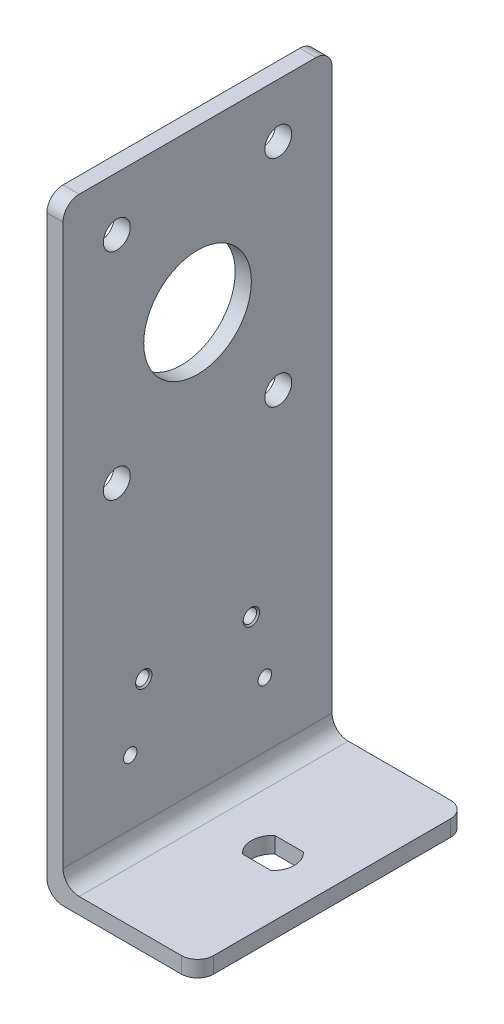
from build123d import *

# Parameters (mm, degrees)
EXTRUDE_THIN1_DEPTH         = 50
HOLE1_D                     = 5
SKETCH3_R                   = 10
CUT_EXTRUDE1_DEPTH          = 125.03225387
M3_TAPPED_HOLE1_D           = 2.5
M3_TAPPED_HOLE1_DEPTH       = 7.5
M3_TAPPED_HOLE1_CSINK_D     = 3.05
M3_TAPPED_HOLE1_CSINK_ANGLE = 90
M3_TAPPED_HOLE1_TIP         = 0.751075774
CUT_EXTRUDE2_DEPTH          = 10
FILLET1_R                   = 3
M3_TAPPED_HOLE2_D           = 2.5
M3_TAPPED_HOLE2_DEPTH       = 7.5
M3_TAPPED_HOLE2_CSINK_D     = 3.05
M3_TAPPED_HOLE2_CSINK_ANGLE = 90
M3_TAPPED_HOLE2_TIP         = 0.751075774
FILLET2_R                   = 3
FILLET3_R                   = 3


with BuildPart() as part:
    # Sketch1 → Extrude-Thin1 (new body)
    with BuildSketch(Plane.XY):
        Polygon((0, 110), (0, 0), (25, 0), (25, -3), (-3, -3), (-3, 110), align=None)
    extrude(amount=EXTRUDE_THIN1_DEPTH)

    # Hole1 (through all)
    with Locations(Plane(origin=(-3, 100, 10), x_dir=(0, -1, 0), z_dir=(-1, 0, 0))):
        with Locations((0, 0), (0, 30), (40, 30), (40, 0)):
            Hole(HOLE1_D / 2)

    # Sketch3 → Cut-Extrude1 (cut, through all)
    with BuildSketch(Plane.ZY.offset(3)):
        with Locations(Location((25, 80, 0), (0, 0, 270))):
            Circle(SKETCH3_R)
    extrude(amount=-CUT_EXTRUDE1_DEPTH, mode=Mode.SUBTRACT)

    # M3 Tapped Hole1
    with Locations(Plane(origin=(-3, 15, 12.5), x_dir=(0, -1, 0), z_dir=(-1, 0, 0))):
        with Locations((0, 0), (0, 25)):
            CounterSinkHole(M3_TAPPED_HOLE1_D / 2, M3_TAPPED_HOLE1_CSINK_D / 2, depth=M3_TAPPED_HOLE1_DEPTH, counter_sink_angle=M3_TAPPED_HOLE1_CSINK_ANGLE)
            with Locations((0, 0, -(M3_TAPPED_HOLE1_DEPTH + M3_TAPPED_HOLE1_TIP / 2))):  # 118° drill point
                Cone(0, M3_TAPPED_HOLE1_D / 2, M3_TAPPED_HOLE1_TIP, mode=Mode.SUBTRACT)

    # Sketch5 → Cut-Extrude2 (cut)
    with BuildSketch(Plane(origin=(0, -3, 0), x_dir=(-1, 0, 0), z_dir=(0, -1, 0))):
        with BuildLine():
            Line((-11.354248689, -22), (-16.645751311, -22))
            ThreePointArc((-16.645751311, -22), (-18, -25), (-16.645751311, -28))
            Line((-16.645751311, -28), (-11.354248689, -28))
            ThreePointArc((-11.354248689, -28), (-10, -25), (-11.354248689, -22))
        make_face()
    extrude(amount=-CUT_EXTRUDE2_DEPTH, mode=Mode.SUBTRACT)

    # Fillet1
    fillet1_edges = [part.edges().sort_by_distance(p)[0] for p in [
        (-1.5, 110, 50),
        (-1.5, 110, 0),
        (25, -1.5, 0),
        (25, -1.5, 50),
    ]]
    fillet(fillet1_edges, radius=FILLET1_R)

    # M3 Tapped Hole2
    with Locations(Plane(origin=(0, 26, 35), x_dir=(0, 1, 0), z_dir=(1, 0, 0))):
        with Locations((0, 0), (0, -20)):
            CounterSinkHole(M3_TAPPED_HOLE2_D / 2, M3_TAPPED_HOLE2_CSINK_D / 2, depth=M3_TAPPED_HOLE2_DEPTH, counter_sink_angle=M3_TAPPED_HOLE2_CSINK_ANGLE)
            with Locations((0, 0, -(M3_TAPPED_HOLE2_DEPTH + M3_TAPPED_HOLE2_TIP / 2))):  # 118° drill point
                Cone(0, M3_TAPPED_HOLE2_D / 2, M3_TAPPED_HOLE2_TIP, mode=Mode.SUBTRACT)

    # Fillet2
    fillet2_edges = [part.edges().sort_by_distance(p)[0] for p in [
        (-3, -3, 25),
    ]]
    fillet(fillet2_edges, radius=FILLET2_R)

    # Fillet3
    fillet3_edges = [part.edges().sort_by_distance(p)[0] for p in [
        (0, 0, 25),
    ]]
    fillet(fillet3_edges, radius=FILLET3_R)


solid = part.part
